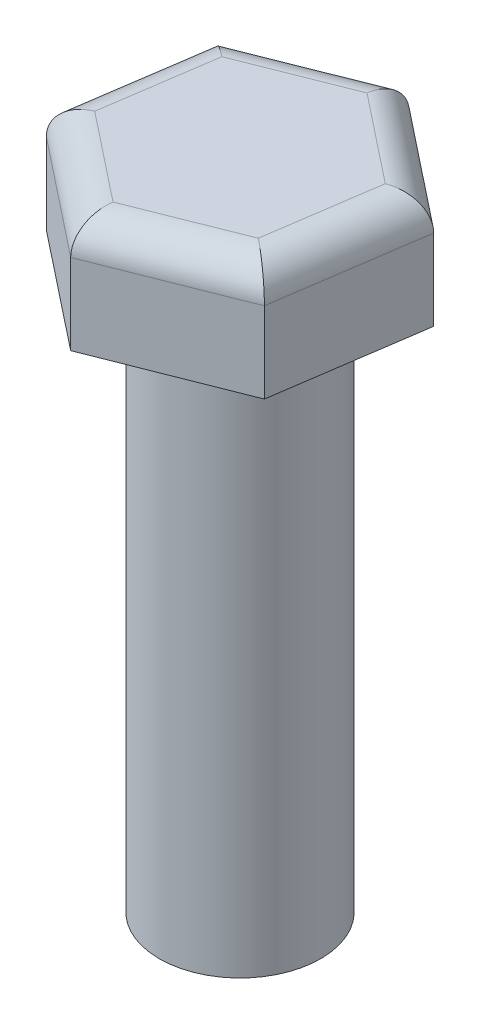
from build123d import *

# Parameters (mm, degrees)
SKETCH_1_R      = 2.5
EXTRUDE_1_DEPTH = 17
EXTRUDE_2_DEPTH = 3.5
FILLET_1_R      = 1


with BuildPart() as part:
    # Эскиз1 → Вытянуть1 (new body)
    with BuildSketch(Plane(origin=(0, 0, 0), x_dir=(1, 0, 0), z_dir=(0, 1, 0))):
        with Locations(Location((0, 0, 0), (0, 0, 270))):
            Circle(SKETCH_1_R)
    extrude(amount=EXTRUDE_1_DEPTH)

    # Эскиз2 → Вытянуть2 (add)
    with BuildSketch(Plane(origin=(0, 17, 0), x_dir=(1, 0, 0), z_dir=(0, 1, 0))):
        Polygon((3.621435705, -2.866799046), (4.293438654, 1.702855795), (0.672002949, 4.569654841), (-3.621435705, 2.866799046), (-4.293438654, -1.702855795), (-0.672002949, -4.569654841), align=None)
    extrude(amount=EXTRUDE_2_DEPTH)

    # Скругление1
    fillet_1_edges = [part.edges().sort_by_distance(p)[0] for p in [
        (1.474716378, 20.5, 3.718226944),
        (3.957437179, 20.5, 0.581971625),
        (2.482720801, 20.5, -3.136255318),
        (-1.474716378, 20.5, -3.718226944),
        (-3.957437179, 20.5, -0.581971625),
        (-2.482720801, 20.5, 3.136255318),
    ]]
    fillet(fillet_1_edges, radius=FILLET_1_R)


solid = part.part
